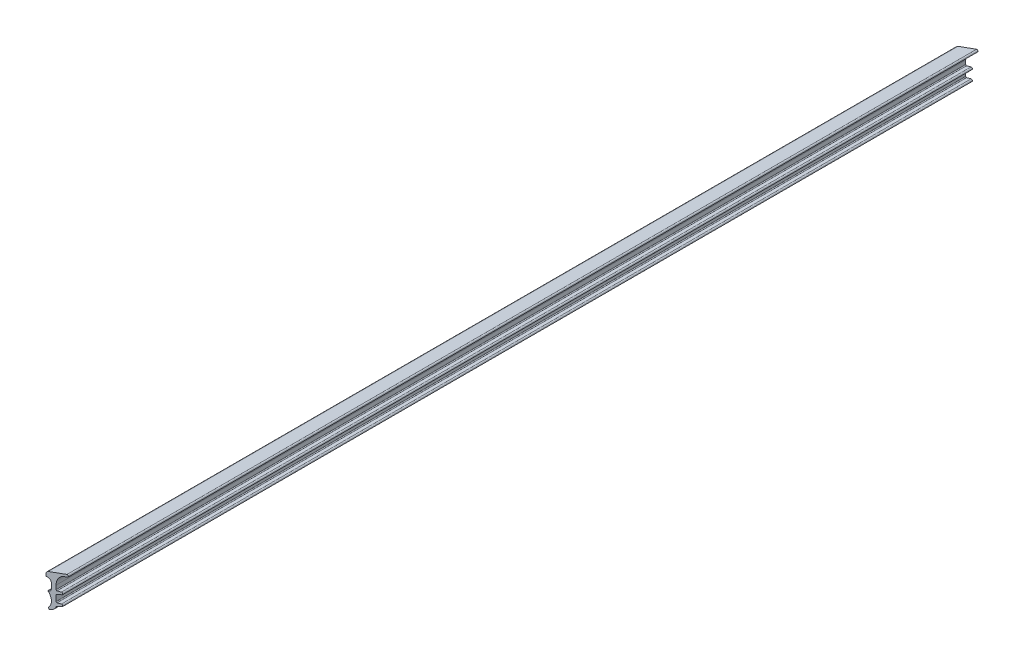
from build123d import *

# Parameters (mm, degrees)
BOSS_EXTRUDE1_DEPTH = 225.79


with BuildPart() as part:
    # Sketch3 → Boss-Extrude1 (new, symmetric)
    with BuildSketch(Plane.XY):
        with BuildLine():
            Line((0, 1.948577375), (0, -0.29197505))
            ThreePointArc((0, -0.29197505), (-0.523261774, -1.555240722), (-1.786527446, -2.078502496))
            ThreePointArc((-1.786527446, -2.078502496), (0, -5.335508002), (-1.348017062, -8.797099424))
            ThreePointArc((-1.348017062, -8.797099424), (-1.44249717, -9.451284226), (-0.829990586, -9.699719191))
            ThreePointArc((-0.829990586, -9.699719191), (1.051740503, -8.676690662), (2.322485679, -6.952536967))
            ThreePointArc((2.322485679, -6.952536967), (2.381708142, -6.755524983), (2.539743588, -6.623821455))
            Line((2.539743588, -6.623821455), (5.300722676, -5.447520291))
            ThreePointArc((5.300722676, -5.447520291), (5.596816097, -4.778241367), (4.949120021, -4.437513638))
            Line((4.949120021, -4.437513638), (2.774145358, -5.033000346))
            ThreePointArc((2.774145358, -5.033000346), (2.463049453, -4.972438368), (2.322485679, -4.68837809))
            Line((2.322485679, -4.68837809), (2.322485679, -1.81903037))
            ThreePointArc((2.322485679, -1.81903037), (2.381708142, -1.622018386), (2.539743588, -1.490314858))
            Line((2.539743588, -1.490314858), (5.300722676, -0.314013694))
            ThreePointArc((5.300722676, -0.314013694), (5.596816097, 0.35526523), (4.949120021, 0.695992958))
            Line((4.949120021, 0.695992958), (2.774145358, 0.10050625))
            ThreePointArc((2.774145358, 0.10050625), (2.463049453, 0.161068229), (2.322485679, 0.445128506))
            Line((2.322485679, 0.445128506), (2.322485679, 2.352673629))
            ThreePointArc((2.322485679, 2.352673629), (3.408861985, 5.798219074), (6.275053034, 7.997524819))
            Line((6.275053034, 7.997524819), (8.06755911, 8.649943675))
            ThreePointArc((8.06755911, 8.649943675), (8.387886595, 9.336888184), (7.700942086, 9.65721567))
            Line((7.700942086, 9.65721567), (-1.504292096, 6.306784428))
            ThreePointArc((-1.504292096, 6.306784428), (-2.356701332, 5.652707816), (-2.679791168, 4.627997771))
            Line((-2.679791168, 4.627997771), (-2.679791168, 3.73510482))
            Line((-2.679791168, 3.73510482), (-1.786527446, 3.73510482))
            ThreePointArc((-1.786527446, 3.73510482), (-0.523261774, 3.211843046), (0, 1.948577375))
        make_face()
    extrude(amount=BOSS_EXTRUDE1_DEPTH, both=True)


solid = part.part
